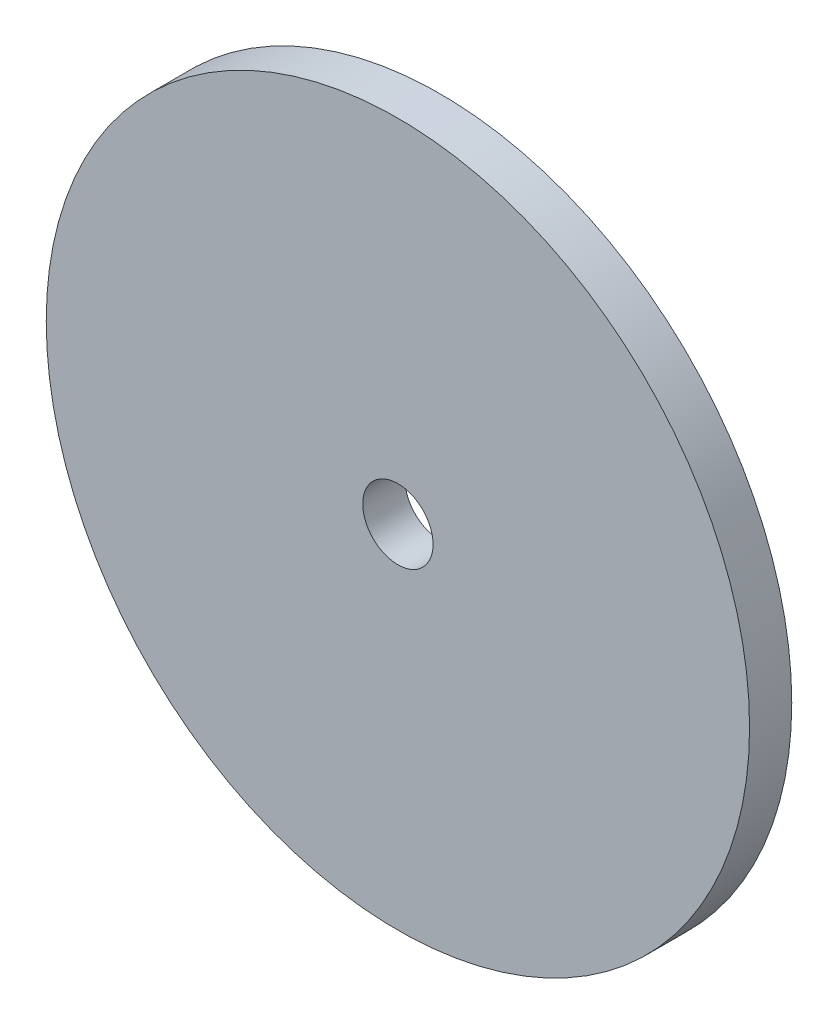
from build123d import *

# Parameters (mm, degrees)
SKETCH1_R               = 25
BOSS_EXTRUDE1_DEPTH     = 3
CUT_EXTRUDE1_DEPTH      = 36.482389998
CUT_EXTRUDE1_DEPTH_BACK = 36.482389998
SKETCH3_R               = 2.5


with BuildPart() as part:
    # Sketch1 → Boss-Extrude1 (new body)
    with BuildSketch(Plane(origin=(0, 0, 0), x_dir=(0, 1, 0), z_dir=(0, 0, 1))):
        with Locations(Location((0, 0, 0), (0, 0, 270))):
            Circle(SKETCH1_R)
    extrude(amount=BOSS_EXTRUDE1_DEPTH)

    # Sketch3 → Cut-Extrude1 (cut, two sides: drawn at the far end of the back side and taken through both)
    with BuildSketch(Plane(origin=(0, 0, 0), x_dir=(0, 1, 0), z_dir=(0, 0, 1)).offset(-CUT_EXTRUDE1_DEPTH_BACK)):
        with Locations(Location((0, 0, 0), (0, 0, 270))):
            Circle(SKETCH3_R)
    extrude(amount=CUT_EXTRUDE1_DEPTH + CUT_EXTRUDE1_DEPTH_BACK, mode=Mode.SUBTRACT)


solid = part.part
